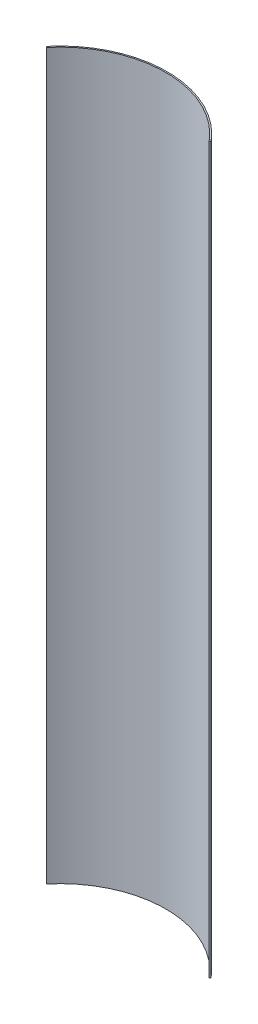
from build123d import *

# Parameters (mm, degrees)
BOSS_EXTRUDE1_DEPTH = 135


with BuildPart() as part:
    # Sketch1 → Boss-Extrude1 (new body)
    with BuildSketch(Plane(origin=(0, 0, 0), x_dir=(1, 0, 0), z_dir=(0, 1, 0))):
        with BuildLine():
            Line((-15.350868462, 12.819939059), (-15.155912432, 12.657125832))
            ThreePointArc((-15.155912432, 12.657125832), (0, 19.746), (15.155912432, 12.657125832))
            Line((15.155912432, 12.657125832), (15.350868462, 12.819939059))
            ThreePointArc((15.350868462, 12.819939059), (0, 20), (-15.350868462, 12.819939059))
        make_face()
    extrude(amount=BOSS_EXTRUDE1_DEPTH)


solid = part.part
